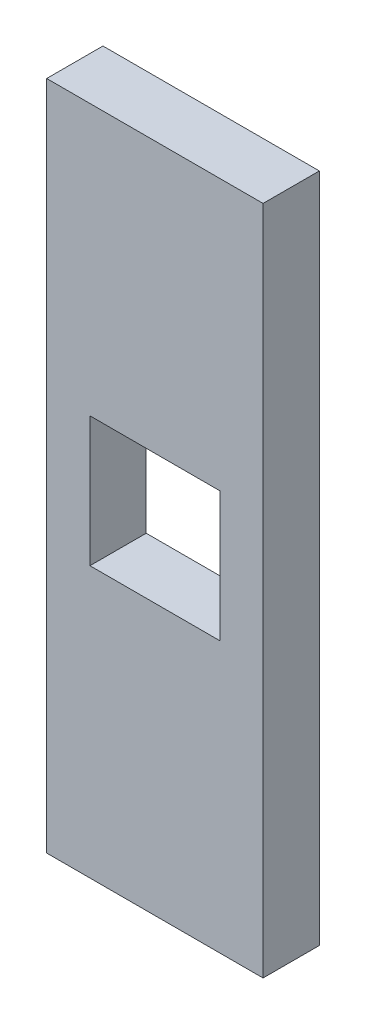
from build123d import *

# Parameters (mm, degrees)
SKETCH1_W           = 12
SKETCH1_H           = 12
BOSS_EXTRUDE1_DEPTH = 5.2


with BuildPart() as part:
    # Sketch1 → Boss-Extrude1 (new body)
    with BuildSketch(Plane.XY):
        Polygon((0, 62), (0, 42), (0, 37), (0, 25), (0, 20), (0, 0), (20, 0), (20, 20), (20, 25), (20, 37), (20, 42), (20, 62), align=None)
        with Locations((10, 31)):
            Rectangle(SKETCH1_W, SKETCH1_H, mode=Mode.SUBTRACT)
    extrude(amount=BOSS_EXTRUDE1_DEPTH)


solid = part.part
